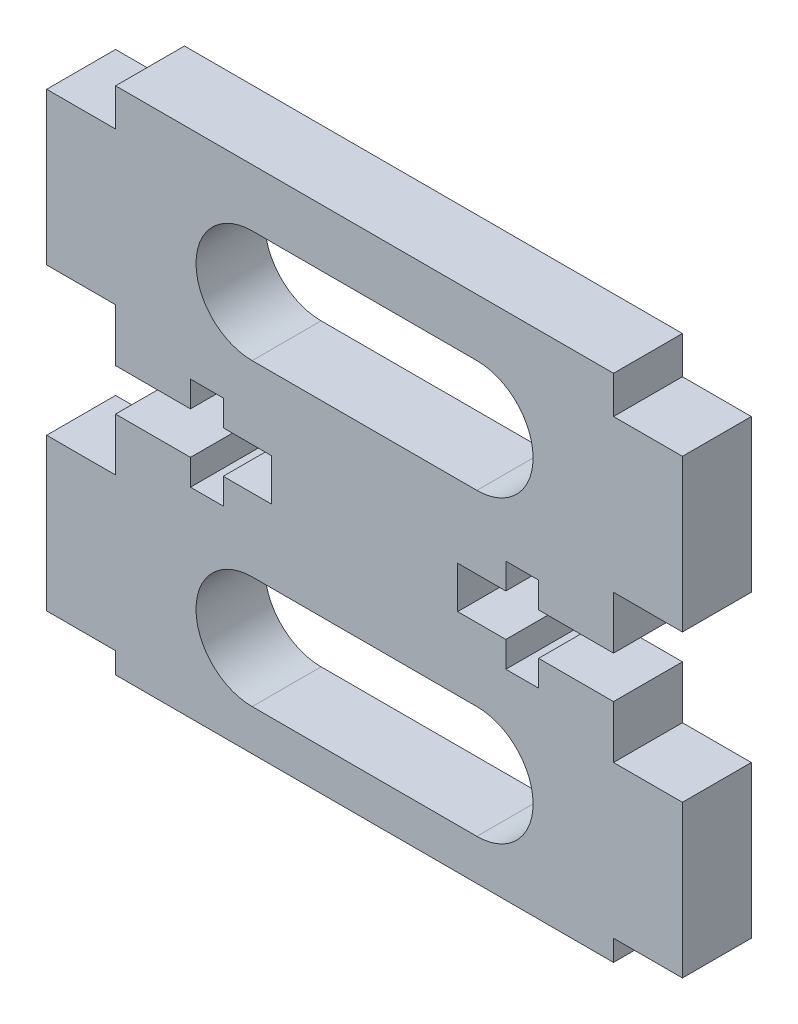
from build123d import *

# Parameters (mm, degrees)
BOSS_EXTRUDE1_DEPTH = 5.842
CUT_EXTRUDE1_DEPTH  = 36.478423215


with BuildPart() as part:
    # Sketch1 → Boss-Extrude1 (new body)
    with BuildSketch(Plane.XY):
        Polygon((21.1058, -20.928), (21.1058, -19.15), (26.9478, -19.15), (26.9478, -6.25), (21.1058, -6.25), (21.1058, -1.778), (14.7558, -1.778), (14.7558, -3.96875), (11.977675, -3.96875), (11.977675, -1.778), (7.8978, -1.778), (7.8978, 1.778), (11.977675, 1.778), (11.977675, 3.96875), (14.7558, 3.96875), (14.7558, 1.778), (21.1058, 1.778), (21.1058, 6.25), (26.9478, 6.25), (26.9478, 19.15), (21.1058, 19.15), (21.1058, 22.325), (-21.1058, 22.325), (-21.1058, 19.15), (-26.9478, 19.15), (-26.9478, 6.25), (-21.1058, 6.25), (-21.1058, 1.778), (-14.7558, 1.778), (-14.7558, 3.96875), (-11.977675, 3.96875), (-11.977675, 1.778), (-7.8978, 1.778), (-7.8978, -1.778), (-11.977675, -1.778), (-11.977675, -3.96875), (-14.7558, -3.96875), (-14.7558, -1.778), (-21.1058, -1.778), (-21.1058, -6.25), (-26.9478, -6.25), (-26.9478, -19.15), (-21.1058, -19.15), (-21.1058, -20.928), align=None)
    extrude(amount=BOSS_EXTRUDE1_DEPTH)

    # Sketch2 → Cut-Extrude1 (cut, through all)
    with BuildSketch(Plane.XY.offset(5.842)):
        with BuildLine():
            Line((-9.525, 17.4625), (9.525, 17.4625))
            ThreePointArc((9.525, 17.4625), (14.2875, 12.7), (9.525, 7.9375))
            Line((9.525, 7.9375), (-9.525, 7.9375))
            ThreePointArc((-9.525, 7.9375), (-14.2875, 12.7), (-9.525, 17.4625))
        make_face()
        with BuildLine():
            Line((-9.525, -17.4625), (9.525, -17.4625))
            ThreePointArc((9.525, -17.4625), (14.2875, -12.7), (9.525, -7.9375))
            Line((9.525, -7.9375), (-9.525, -7.9375))
            ThreePointArc((-9.525, -7.9375), (-14.2875, -12.7), (-9.525, -17.4625))
        make_face()
    extrude(amount=-CUT_EXTRUDE1_DEPTH, mode=Mode.SUBTRACT)


solid = part.part
